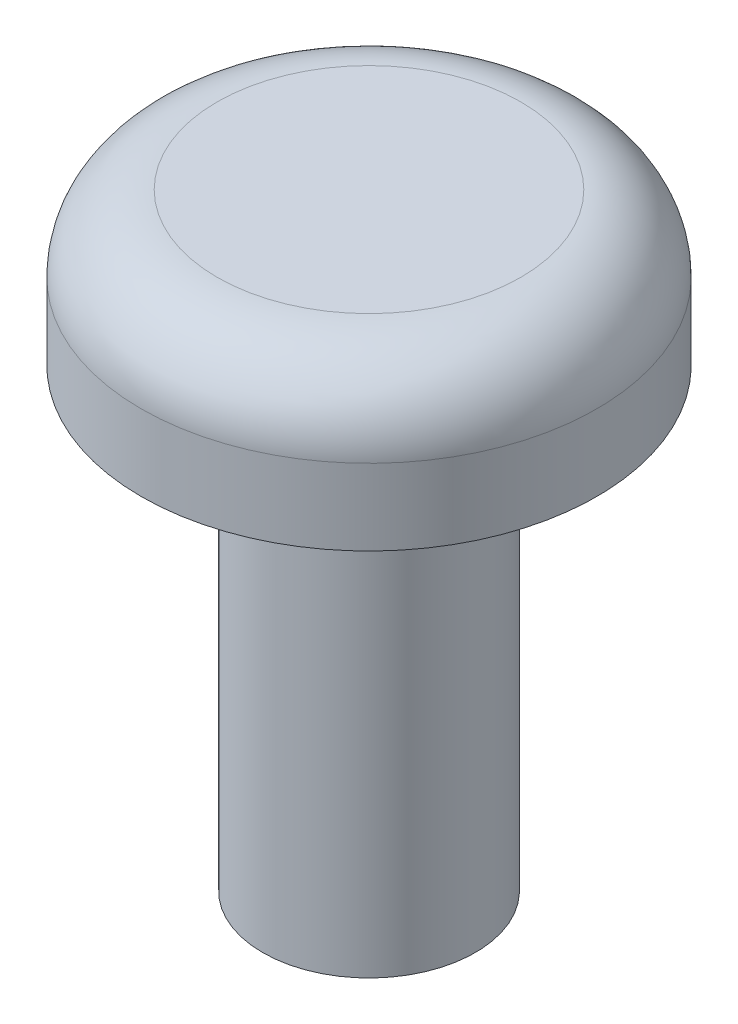
from build123d import *

# Parameters (mm, degrees)
SKETCH1_R           = 1.4
BOSS_EXTRUDE1_DEPTH = 6
SKETCH2_R           = 3
BOSS_EXTRUDE2_DEPTH = 2
FILLET1_R           = 1


with BuildPart() as part:
    # Sketch1 → Boss-Extrude1 (new body)
    with BuildSketch(Plane(origin=(0, 0, 0), x_dir=(1, 0, 0), z_dir=(0, 1, 0))):
        with Locations(Location((0, 0, 0), (0, 0, 270))):
            Circle(SKETCH1_R)
    extrude(amount=BOSS_EXTRUDE1_DEPTH)

    # Sketch2 → Boss-Extrude2 (add)
    with BuildSketch(Plane(origin=(0, 6, 0), x_dir=(1, 0, 0), z_dir=(0, 1, 0))):
        with Locations(Location((0, 0, 0), (0, 0, 270))):
            Circle(SKETCH2_R)
    extrude(amount=BOSS_EXTRUDE2_DEPTH)

    # Fillet1
    fillet1_edges = [part.edges().sort_by_distance(p)[0] for p in [
        (0, 8, -3),
    ]]
    fillet(fillet1_edges, radius=FILLET1_R)


solid = part.part
